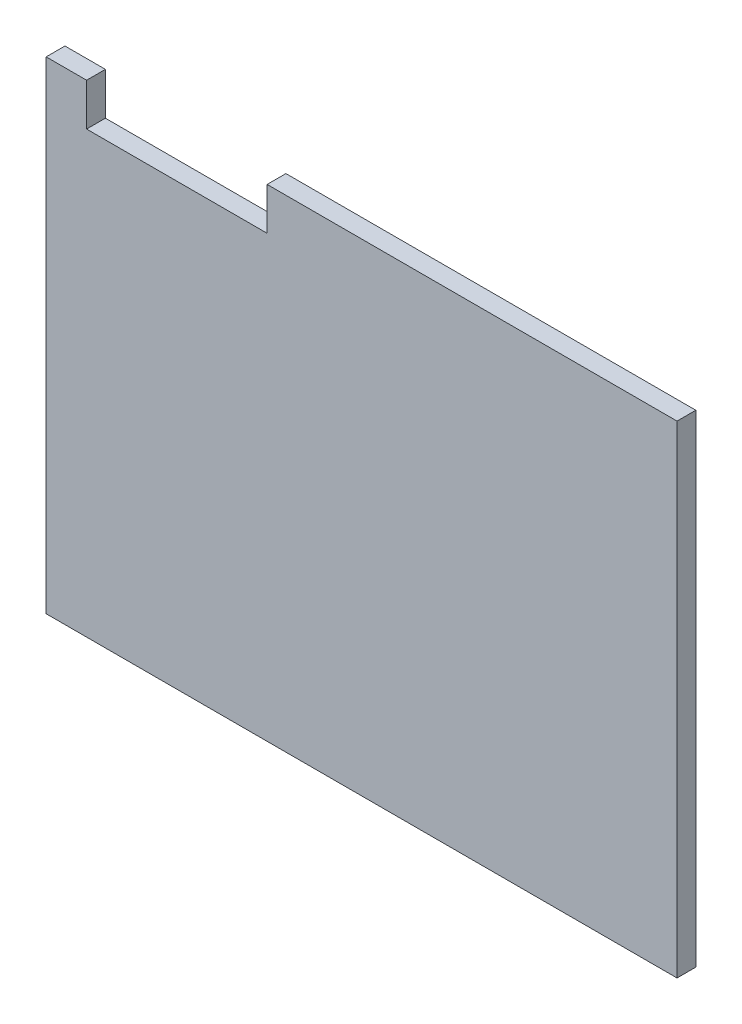
from build123d import *

# Parameters (mm, degrees)
BOSS_EXTRUDE1_DEPTH = 2
CUT_EXTRUDE1_DEPTH  = 104.743351649
SKETCH4_W           = 67.1
SKETCH4_H           = 9
BOSS_EXTRUDE2_DEPTH = 2


with BuildPart() as part:
    # Sketch2 → Boss-Extrude1 (new body)
    with BuildSketch(Plane.XY):
        Polygon((-88.945731411, -6.4), (-88.945731411, -1.9), (-93.645731411, -1.9), (-93.645731411, -44.6), (-26.145731411, -44.6), (-26.145731411, -1.9), (-70.145731411, -1.9), (-70.145731411, -6.4), align=None)
    extrude(amount=BOSS_EXTRUDE1_DEPTH)

    # Sketch3 → Cut-Extrude1 (cut, through all)
    with BuildSketch(Plane.XY.offset(2)):
        Polygon((-88.945731411, -1.9), (-93.645731411, -1.9), (-93.645731411, -44.6), (-26.145731411, -44.6), (-26.145731411, -1.9), (-70.145731411, -1.9), (-70.145731411, -6.4), (-88.945731411, -6.4), align=None)
        Polygon((-89.145731411, -2.1), (-93.445731411, -2.1), (-93.445731411, -44.4), (-26.345731411, -44.4), (-26.345731411, -2.1), (-69.945731411, -2.1), (-69.945731411, -6.6), (-89.145731411, -6.6), align=None, mode=Mode.SUBTRACT)
    extrude(amount=-CUT_EXTRUDE1_DEPTH, mode=Mode.SUBTRACT)

    # Sketch4 → Boss-Extrude2 (add)
    with BuildSketch(Plane.XY.offset(2)):
        with Locations((-59.895731411, -48.9)):
            Rectangle(SKETCH4_W, SKETCH4_H)
    extrude(amount=-BOSS_EXTRUDE2_DEPTH)


solid = part.part
